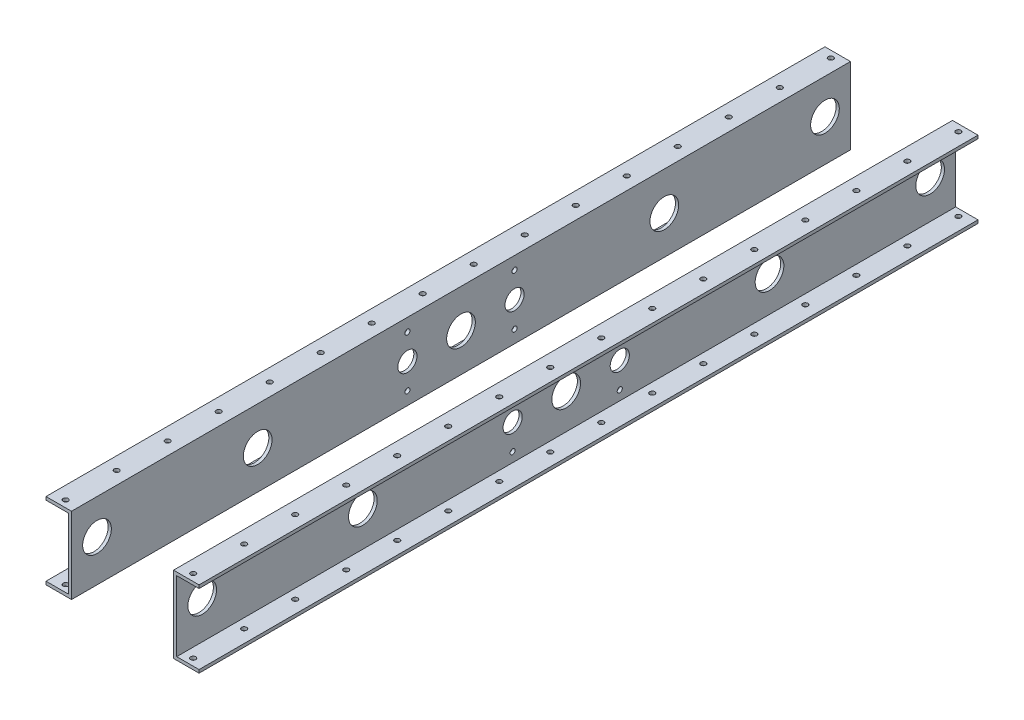
from build123d import *

# Parameters (mm, degrees)
BOSS_EXTRUDE1_START = -342.9
SKETCH4_R           = 2.54
SKETCH4_R_2         = 9.525
SKETCH4_R_3         = 14.2875
BOSS_EXTRUDE1_DEPTH = 3.175
BOSS_EXTRUDE2_DEPTH = 3.175
BOSS_EXTRUDE3_START = -76.2
BOSS_EXTRUDE3_DEPTH = 3.175
SKETCH9_R           = 2.54
CUT_EXTRUDE2_DEPTH  = 541.266885435
LPATTERN1_COUNT     = 10
LPATTERN1_PITCH     = 50.8


with BuildPart() as part:
    # Sketch4 → Boss-Extrude1 (new body)
    with BuildSketch(Plane(origin=(0, 0, 0), x_dir=(0, 0, -1), z_dir=(1, 0, 0)).offset(BOSS_EXTRUDE1_START)):
        with BuildLine():
            Line((387.862059884, 88.9), (0, 88.9))
            Line((0, 88.9), (0, 65.0875))
            ThreePointArc((0, 65.0875), (14.2875, 50.8), (0, 36.5125))
            Line((0, 36.5125), (0, 12.7))
            Line((0, 12.7), (387.862059884, 12.7))
            Line((387.862059884, 12.7), (387.862059884, 88.9))
        make_face()
        with Locations((53.34, 25.4)):
            Circle(SKETCH4_R, mode=Mode.SUBTRACT)
        with Locations((53.34, 50.8)):
            Circle(SKETCH4_R_2, mode=Mode.SUBTRACT)
        with Locations((53.34, 76.2)):
            Circle(SKETCH4_R, mode=Mode.SUBTRACT)
        with Locations((202.46848, 50.8)):
            Circle(SKETCH4_R_3, mode=Mode.SUBTRACT)
        with Locations((362.462059884, 53.975)):
            Circle(SKETCH4_R_3, mode=Mode.SUBTRACT)
    extrude(amount=-BOSS_EXTRUDE1_DEPTH)

    # Sketch7 → Boss-Extrude2 (add)
    with BuildSketch(Plane(origin=(0, 88.9, 0), x_dir=(1, 0, 0), z_dir=(0, 1, 0))):
        Polygon((-344.4875, 0), (-368.3, 0), (-368.3, 387.862059884), (-342.9, 387.862059884), align=None)
    extrude(amount=-BOSS_EXTRUDE2_DEPTH)

    # Sketch7<2> → Boss-Extrude3 (add)
    with BuildSketch(Plane(origin=(0, 88.9, 0), x_dir=(1, 0, 0), z_dir=(0, 1, 0)).offset(BOSS_EXTRUDE3_START)):
        Polygon((-344.4875, 0), (-368.3, 0), (-368.3, 387.862059884), (-342.9, 387.862059884), align=None)
    extrude(amount=BOSS_EXTRUDE3_DEPTH)

    # Sketch9 → Cut-Extrude2 (cut, through all)
    with BuildSketch(Plane(origin=(0, 88.9, 0), x_dir=(1, 0, 0), z_dir=(0, 1, 0))):
        with Locations(Location((-355.6, 381, 0), (0, 0, 270))):
            Circle(SKETCH9_R)
    cut_extrude2 = extrude(amount=-CUT_EXTRUDE2_DEPTH, mode=Mode.SUBTRACT)

    # LPattern1: Cut-Extrude2 ×10
    with Locations(*[(0, 0, i * LPATTERN1_PITCH) for i in range(1, LPATTERN1_COUNT)]):
        add(cut_extrude2, mode=Mode.SUBTRACT)

    # Mirror1: part across plane


with BuildPart() as part_1:
    add(part.part)
    add(part.part.mirror(Plane(origin=(-346.075, 88.9, 0), x_dir=(1, 0, 0), z_dir=(0, 0, 1))))


with BuildPart() as body_2:
    # Mirror4: mirrored copy
    add(part_1.part.mirror(Plane(origin=(-292.1, 0, 0), x_dir=(0, 0, 1), z_dir=(1, 0, 0))))


solid = Compound([part_1.part, body_2.part])
